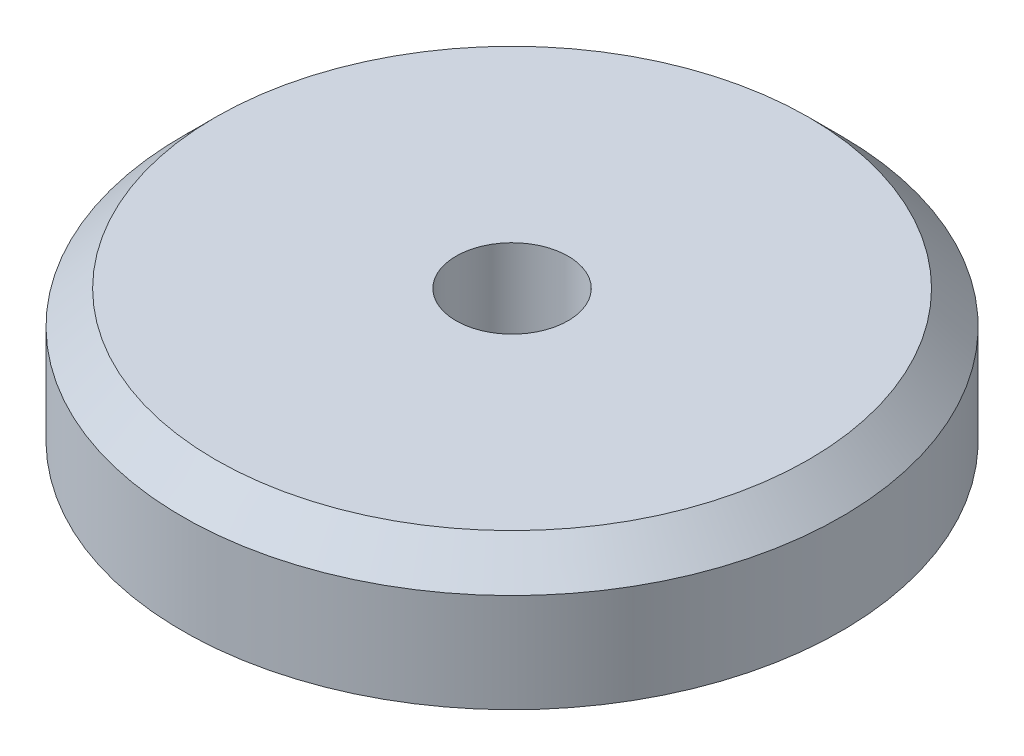
from build123d import *

# Parameters (mm, degrees)
M8_TAPPED_HOLE1_D     = 6.8
M8_TAPPED_HOLE1_DEPTH = 21.25
CHAMFER1_SIZE         = 1


with BuildPart() as part:
    # Sketch1 → Revolve1 (revolve)
    with BuildSketch(Plane.XY, mode=Mode.PRIVATE) as revolve1_sk:
        Polygon((0, 0), (0, 11), (18, 11), (20, 9), (20, 3), (15.5, 3), (13.5, 0), align=None)
    revolve(revolve1_sk.sketch.rotate(Axis((0, 0, 0), (0, 1, 0)), 90), axis=Axis((0, 0, 0), (0, 1, 0)))

    # M8 Tapped Hole1
    with Locations(Plane(origin=(0, 11, 0), x_dir=(1, 0, 0), z_dir=(0, 1, 0))):
        with Locations((0, 0)):
            Hole(M8_TAPPED_HOLE1_D / 2, depth=M8_TAPPED_HOLE1_DEPTH)

    # Chamfer1
    chamfer1_edges = [part.edges().sort_by_distance(p)[0] for p in [
        (3.4, 0, 0),
    ]]
    chamfer(chamfer1_edges, length=CHAMFER1_SIZE)


solid = part.part
